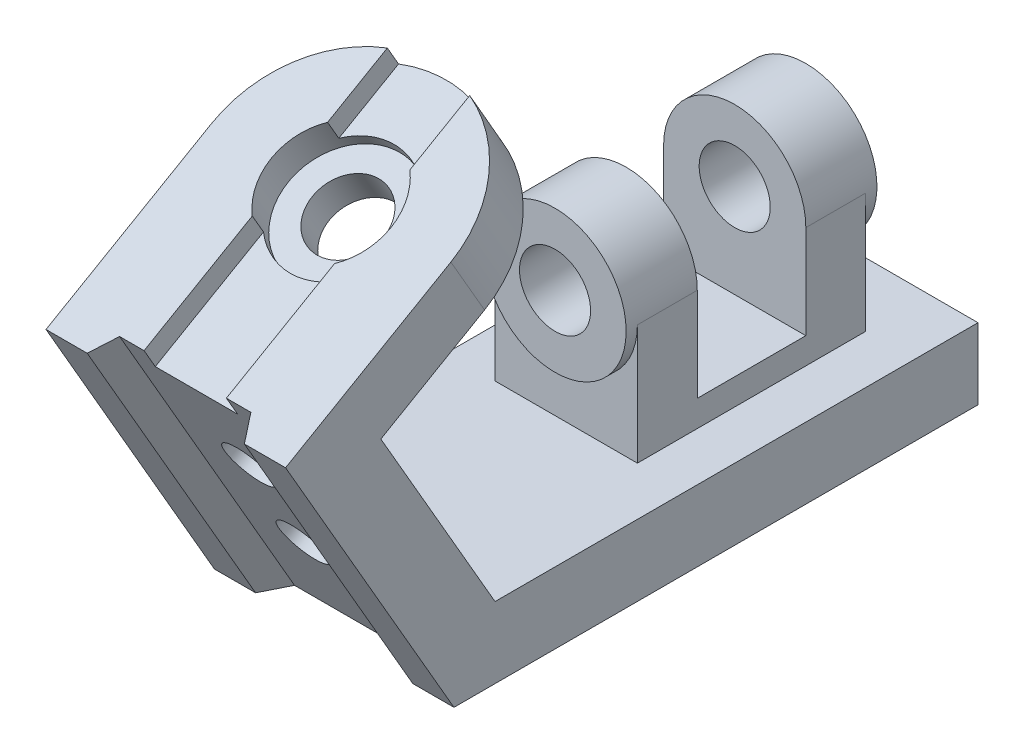
from build123d import *

# Parameters (mm, degrees)
BASE_DEPTH          = 32
SKETCH2_R           = 32
BOSS_EXTRUDE2_DEPTH = 18
SKETCH3_R           = 16
SKETCH3_R_2         = 9.5
CUT_EXTRUDE1_DEPTH  = 9
SKETCH3_4_R         = 9.5
CUT_EXTRUDE2_DEPTH  = 18
CUT_EXTRUDE3_DEPTH  = 204.283053893
SKETCH6_W           = 22
SKETCH6_H           = 100
CUT_EXTRUDE4_DEPTH  = 6
SKETCH7_R           = 6.5
CUT_EXTRUDE5_DEPTH  = 13
SKETCH8_W           = 38
SKETCH8_H           = 61
BOSS_EXTRUDE4_DEPTH = 32
SKETCH10_R          = 19
BOSS_EXTRUDE5_DEPTH = 33.5
SKETCH11_R          = 9.5
CUT_EXTRUDE6_DEPTH  = 67
SKETCH12_W          = 29
SKETCH12_H          = 64.607754356
CUT_EXTRUDE8_DEPTH  = 33.5


with BuildPart() as part:
    # Sketch1 → Base (new, symmetric)
    with BuildSketch(Plane(origin=(0, 0, 0), x_dir=(0, 0, -1), z_dir=(1, 0, 0))):
        Polygon((0, 0), (140, 0), (140, 19), (10.969655115, 19), (-19.545517328, 71.853829072), (8.167295593, 87.853829072), (-0.832704407, 103.442286341), (-45, 77.942286341), align=None)
    extrude(amount=BASE_DEPTH, both=True)

    # Sketch2 → Boss-Extrude2 (add)
    with BuildSketch(Plane(origin=(0, 77.942286341, 45), x_dir=(1, 0, 0), z_dir=(0, 0.866025403784436, 0.5000000000000047))):
        with Locations((0, 51)):
            Circle(SKETCH2_R)
    extrude(amount=-BOSS_EXTRUDE2_DEPTH)

    # Sketch3 → Cut-Extrude1 (cut)
    # profile 1 of 2: a face of its own
    with BuildSketch(Plane(origin=(0, 77.942286341, 45), x_dir=(1, 0, 0), z_dir=(0, 0.866025403784436, 0.5000000000000047))):
        with Locations(Location((0, 51, 0), (0, 0, 270))):
            Circle(SKETCH3_R)
        with Locations((0, 51)):
            Circle(SKETCH3_R_2, mode=Mode.SUBTRACT)
    # profile 2 of 2: a face of its own
    with BuildSketch(Plane(origin=(0, 77.942286341, 45), x_dir=(1, 0, 0), z_dir=(0, 0.866025403784436, 0.5000000000000047))):
        with Locations((0, 51)):
            Circle(SKETCH3_R_2)
    extrude(amount=-CUT_EXTRUDE1_DEPTH, mode=Mode.SUBTRACT)

    # Sketch3<4> → Cut-Extrude2 (cut)
    with BuildSketch(Plane(origin=(0, 77.942286341, 45), x_dir=(1, 0, 0), z_dir=(0, 0.866025403784436, 0.5000000000000047))):
        with Locations(Location((0, 51, 0), (0, 0, 270))):
            Circle(SKETCH3_4_R)
    extrude(amount=-CUT_EXTRUDE2_DEPTH, mode=Mode.SUBTRACT)

    # Sketch5 → Cut-Extrude3 (cut, through all)
    with BuildSketch(Plane(origin=(0, 77.942286341, 45), x_dir=(1, 0, 0), z_dir=(0, 0.866025403784436, 0.5000000000000047))):
        Polygon((-17.535898385, 6), (17.535898385, 6), (21, 0), (21, -1.787460258), (-21, -1.787460258), (-21, 0), align=None)
    extrude(amount=-CUT_EXTRUDE3_DEPTH, mode=Mode.SUBTRACT)

    # Sketch6 → Cut-Extrude4 (cut)
    with BuildSketch(Plane(origin=(0, 77.942286341, 45), x_dir=(1, 0, 0), z_dir=(0, 0.866025403784436, 0.5000000000000047))):
        with Locations((0, 41.5)):
            Rectangle(SKETCH6_W, SKETCH6_H)
    extrude(amount=-CUT_EXTRUDE4_DEPTH, mode=Mode.SUBTRACT)

    # Sketch7 → Cut-Extrude5 (cut)
    with BuildSketch(Plane(origin=(0, 3, -5.196152423), x_dir=(1, 0, 0), z_dir=(0, -0.5000000000000048, 0.8660254037844359))):
        with Locations(Location((0, 56, 0), (0, 0, 270))):
            Circle(SKETCH7_R)
        with Locations(Location((0, 27, 0), (0, 0, 270))):
            Circle(SKETCH7_R)
    extrude(amount=-CUT_EXTRUDE5_DEPTH, mode=Mode.SUBTRACT)

    # Sketch8 → Boss-Extrude4 (add)
    with BuildSketch(Plane(origin=(0, 19, 0), x_dir=(1, 0, 0), z_dir=(0, 1, 0))):
        with Locations((0, 92.5)):
            Rectangle(SKETCH8_W, SKETCH8_H)
    extrude(amount=BOSS_EXTRUDE4_DEPTH)

    # Sketch10 → Boss-Extrude5 (add, symmetric)
    with BuildSketch(Plane(origin=(0, 0, -92.5), x_dir=(-1, 0, 0), z_dir=(0, 0, -1))):
        with Locations(Location((0, 51, 0), (0, 0, 90))):
            Circle(SKETCH10_R)
    extrude(amount=BOSS_EXTRUDE5_DEPTH, both=True)

    # Sketch11 → Cut-Extrude6 (cut)
    with BuildSketch(Plane(origin=(0, 0, -126), x_dir=(-1, 0, 0), z_dir=(0, 0, -1))):
        with Locations(Location((0, 51, 0), (0, 0, 90))):
            Circle(SKETCH11_R)
    extrude(amount=-CUT_EXTRUDE6_DEPTH, mode=Mode.SUBTRACT)

    # Sketch12 → Cut-Extrude8 (cut, symmetric)
    with BuildSketch(Plane(origin=(0, 0, 0), x_dir=(0, 0, -1), z_dir=(1, 0, 0))):
        with Locations((92.5, 58.303877178)):
            Rectangle(SKETCH12_W, SKETCH12_H)
    extrude(amount=CUT_EXTRUDE8_DEPTH, both=True, mode=Mode.SUBTRACT)


solid = part.part
